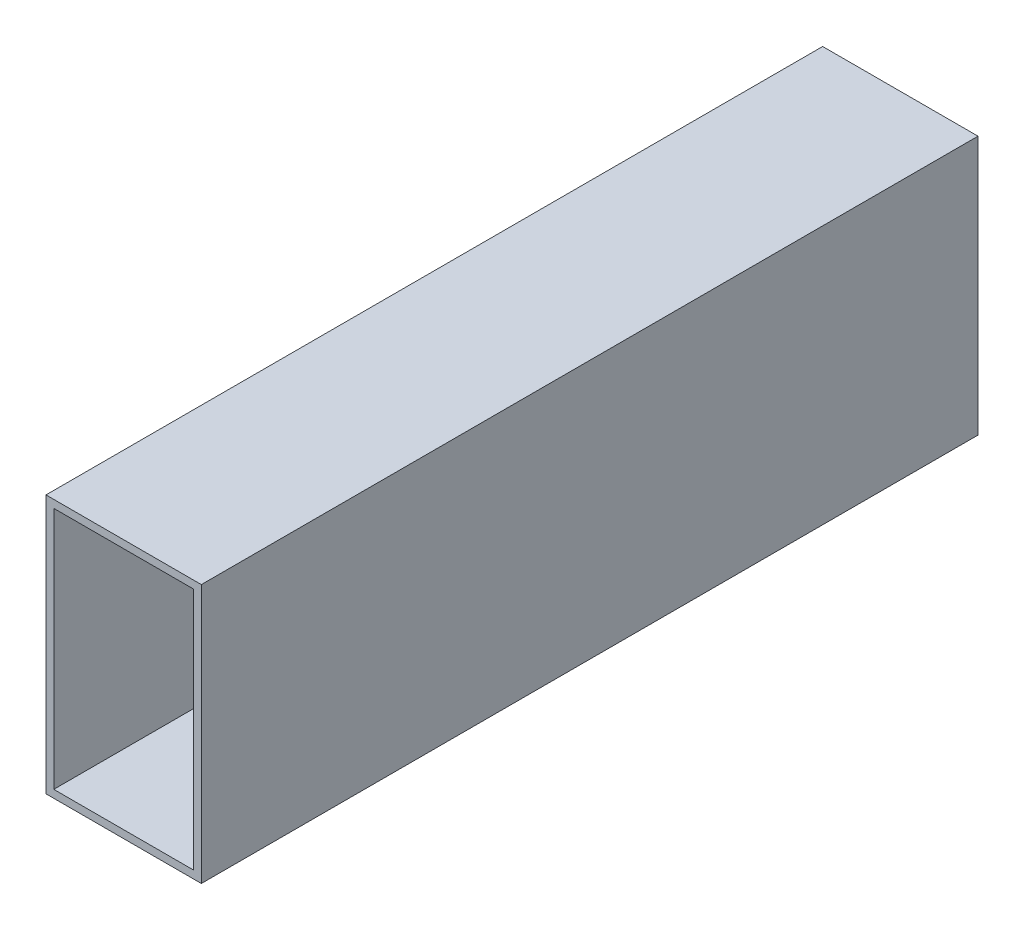
from build123d import *

# Parameters (mm, degrees)
ESBO_O1_W                = 30
ESBO_O1_H                = 50
ESBO_O1_W_2              = 27
ESBO_O1_H_2              = 47
RESSALTO_EXTRUS_O1_DEPTH = 150


with BuildPart() as part:
    # Esboço1 → Ressalto-extrusão1 (new body)
    with BuildSketch(Plane.XY):
        with Locations((15, 25)):
            Rectangle(ESBO_O1_W, ESBO_O1_H)
        with Locations((15, 25)):
            Rectangle(ESBO_O1_W_2, ESBO_O1_H_2, mode=Mode.SUBTRACT)
    extrude(amount=RESSALTO_EXTRUS_O1_DEPTH)


solid = part.part
